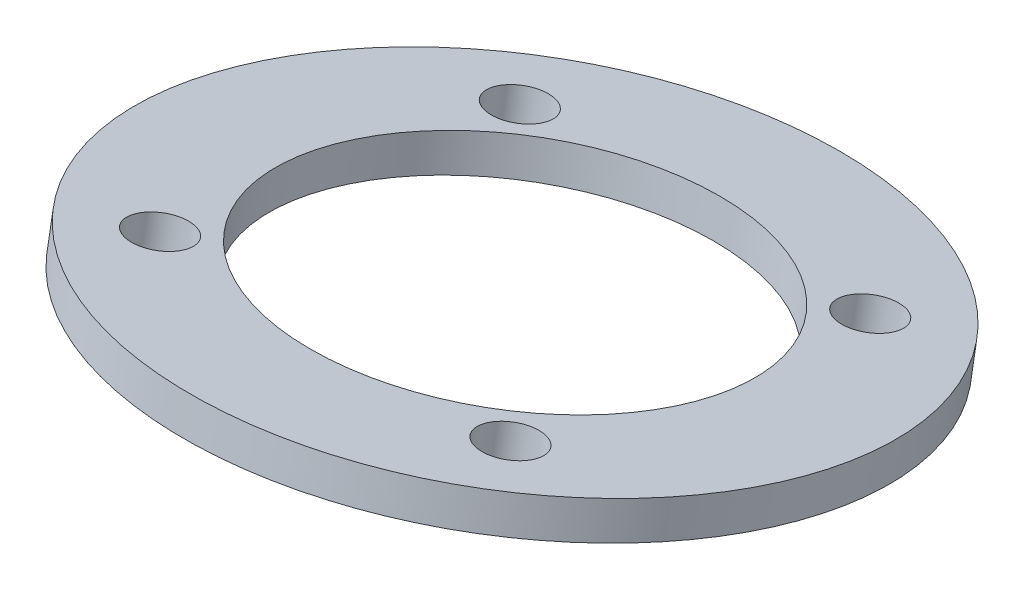
from build123d import *

# Parameters (mm, degrees)
SKETCH1_R           = 18.25
SKETCH1_R_2         = 11.5
SKETCH1_R_3         = 1.6
BOSS_EXTRUDE1_DEPTH = 2


with BuildPart() as part:
    # Sketch1 → Boss-Extrude1 (new body)
    with BuildSketch(Plane(origin=(0, 86.126437578, -15.186414697), x_dir=(1, 0, 0), z_dir=(0, -0.9848077530122081, 0.17364817766693072))):
        with Locations(Location((74.806164697, -177.414273966, 0), (0, 0, 270))):
            Circle(SKETCH1_R)
        with Locations(Location((74.806164697, -177.414273966, 0), (0, 0, 270))):
            Circle(SKETCH1_R_2, mode=Mode.SUBTRACT)
        with Locations(Location((64.702692178, -167.723048911, 0), (0, 0, 270))):
            Circle(SKETCH1_R_3, mode=Mode.SUBTRACT)
        with Locations(Location((84.497389752, -167.310801447, 0), (0, 0, 270))):
            Circle(SKETCH1_R_3, mode=Mode.SUBTRACT)
        with Locations(Location((84.909637216, -187.105499021, 0), (0, 0, 270))):
            Circle(SKETCH1_R_3, mode=Mode.SUBTRACT)
        with Locations(Location((65.114939642, -187.517746485, 0), (0, 0, 270))):
            Circle(SKETCH1_R_3, mode=Mode.SUBTRACT)
    extrude(amount=-BOSS_EXTRUDE1_DEPTH)


solid = part.part
